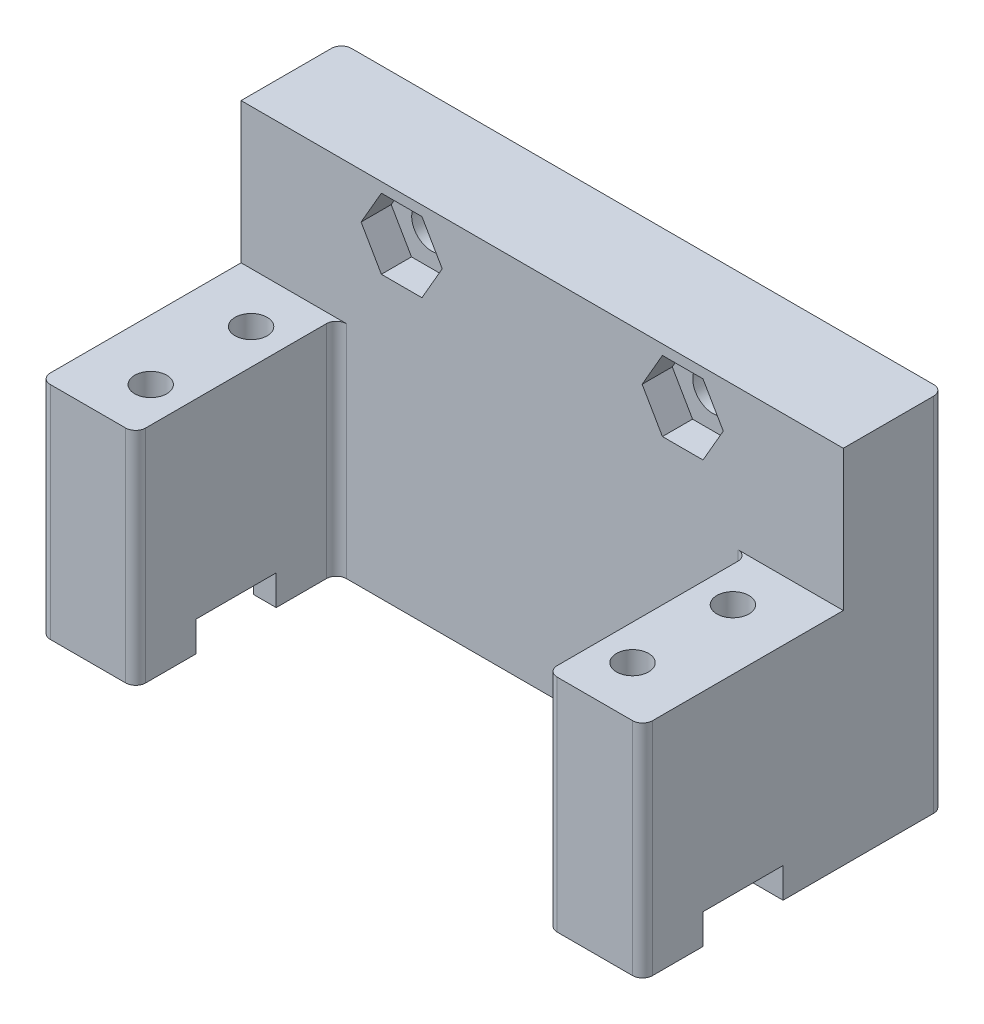
from build123d import *

# Parameters (mm, degrees)
SKETCH1_W           = 60
SKETCH1_H           = 36
SKETCH1_R           = 2
BOSS_EXTRUDE1_DEPTH = 10
SKETCH2_W           = 9.5
SKETCH2_H           = 20
BOSS_EXTRUDE2_DEPTH = 22
CUT_EXTRUDE1_REACH  = 72.597
SKETCH3_R           = 1.6
CUT_EXTRUDE2_DEPTH  = 3
LPATTERN1_COUNT     = 2
LPATTERN1_PITCH     = 28
FILLET1_R           = 1
SKETCH6_W           = 8
SKETCH6_H           = 3
CUT_EXTRUDE3_DEPTH  = 77.131465243


with BuildPart() as part:
    # Sketch1 → Boss-Extrude1 (new body)
    with BuildSketch(Plane.XY):
        with Locations((30, -18)):
            Rectangle(SKETCH1_W, SKETCH1_H)
        with Locations((16, -4.5)):
            Circle(SKETCH1_R, mode=Mode.SUBTRACT)
        with Locations((44, -4.5)):
            Circle(SKETCH1_R, mode=Mode.SUBTRACT)
    extrude(amount=BOSS_EXTRUDE1_DEPTH)

    # Sketch2 → Boss-Extrude2 (add)
    with BuildSketch(Plane.XZ.offset(36)):
        with Locations((4.75, 20)):
            Rectangle(SKETCH2_W, SKETCH2_H)
        with Locations((55.25, 20)):
            Rectangle(SKETCH2_W, SKETCH2_H)
    extrude(amount=-BOSS_EXTRUDE2_DEPTH)

    # Sketch3 → Cut-Extrude1 (cut, up to next)
    with BuildSketch(Plane(origin=(0, -14, 0), x_dir=(1, 0, 0), z_dir=(0, 1, 0)), mode=Mode.PRIVATE) as cut_extrude1_sk1:
        with Locations(Location((6, -15, 0), (0, 0, 270))):
            Circle(SKETCH3_R)
    cut_extrude1_tool1 = extrude(cut_extrude1_sk1.sketch, amount=-CUT_EXTRUDE1_REACH, mode=Mode.PRIVATE) & part.part
    # Sketch3 → Cut-Extrude1 (cut, up to next)
    with BuildSketch(Plane(origin=(0, -14, 0), x_dir=(1, 0, 0), z_dir=(0, 1, 0)), mode=Mode.PRIVATE) as cut_extrude1_sk2:
        with Locations(Location((54, -15, 0), (0, 0, 270))):
            Circle(SKETCH3_R)
    cut_extrude1_tool2 = extrude(cut_extrude1_sk2.sketch, amount=-CUT_EXTRUDE1_REACH, mode=Mode.PRIVATE) & part.part
    # Sketch3 → Cut-Extrude1 (cut, up to next)
    with BuildSketch(Plane(origin=(0, -14, 0), x_dir=(1, 0, 0), z_dir=(0, 1, 0)), mode=Mode.PRIVATE) as cut_extrude1_sk3:
        with Locations(Location((54, -25, 0), (0, 0, 270))):
            Circle(SKETCH3_R)
    cut_extrude1_tool3 = extrude(cut_extrude1_sk3.sketch, amount=-CUT_EXTRUDE1_REACH, mode=Mode.PRIVATE) & part.part
    # Sketch3 → Cut-Extrude1 (cut, up to next)
    with BuildSketch(Plane(origin=(0, -14, 0), x_dir=(1, 0, 0), z_dir=(0, 1, 0)), mode=Mode.PRIVATE) as cut_extrude1_sk4:
        with Locations(Location((6, -25, 0), (0, 0, 270))):
            Circle(SKETCH3_R)
    cut_extrude1_tool4 = extrude(cut_extrude1_sk4.sketch, amount=-CUT_EXTRUDE1_REACH, mode=Mode.PRIVATE) & part.part
    add(cut_extrude1_tool1.solids().sort_by_distance((6, -14, 15))[0], mode=Mode.SUBTRACT)
    add(cut_extrude1_tool2.solids().sort_by_distance((54, -14, 15))[0], mode=Mode.SUBTRACT)
    add(cut_extrude1_tool3.solids().sort_by_distance((54, -14, 25))[0], mode=Mode.SUBTRACT)
    add(cut_extrude1_tool4.solids().sort_by_distance((6, -14, 25))[0], mode=Mode.SUBTRACT)

    # Sketch4 → Cut-Extrude2 (cut)
    with BuildSketch(Plane.XY.offset(10)):
        Polygon((13.979274058, -1), (11.958548116, -4.5), (13.979274058, -8), (18.020725942, -8), (20.041451884, -4.5), (18.020725942, -1), align=None)
    cut_extrude2 = extrude(amount=-CUT_EXTRUDE2_DEPTH, mode=Mode.SUBTRACT)

    # LPattern1: Cut-Extrude2 ×2
    with Locations(*[(i * LPATTERN1_PITCH, 0, 0) for i in range(1, LPATTERN1_COUNT)]):
        add(cut_extrude2, mode=Mode.SUBTRACT)

    # Fillet1
    fillet1_edges = [part.edges().sort_by_distance(p)[0] for p in [
        (0, -25, 30),
        (9.5, -25, 30),
        (9.5, -25, 10),
        (60, -25, 30),
        (50.5, -25, 10),
        (50.5, -25, 30),
        (60, -18, 0),
        (0, -18, 0),
    ]]
    fillet(fillet1_edges, radius=FILLET1_R)

    # Sketch6 → Cut-Extrude3 (cut, through all)
    with BuildSketch(Plane(origin=(60, 0, 0), x_dir=(0, 0, -1), z_dir=(1, 0, 0))):
        with Locations((-20, -34.5)):
            Rectangle(SKETCH6_W, SKETCH6_H)
    extrude(amount=-CUT_EXTRUDE3_DEPTH, mode=Mode.SUBTRACT)


solid = part.part
